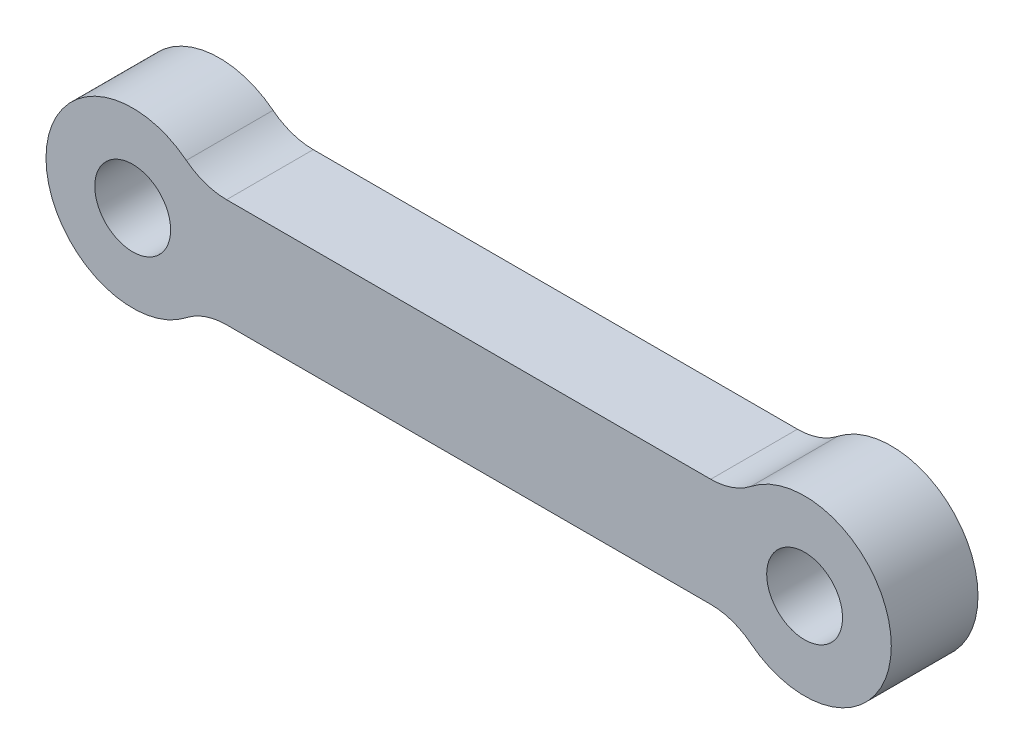
from build123d import *

# Parameters (mm, degrees)
SKETCH1_R           = 1.750000249
BOSS_EXTRUDE1_DEPTH = 4
FILLET1_R           = 3


with BuildPart() as part:
    # Sketch1 → Boss-Extrude1 (new body)
    with BuildSketch(Plane.XY):
        with BuildLine():
            Line((3.122495264, 2.500004665), (27.877504736, 2.500004665))
            ThreePointArc((27.877504736, 2.500004665), (35, 0), (27.877504736, -2.500004665))
            Line((27.877504736, -2.500004665), (3.122495264, -2.500004665))
            ThreePointArc((3.122495264, -2.500004665), (-4, 0), (3.122495264, 2.500004665))
        make_face()
        Circle(SKETCH1_R, mode=Mode.SUBTRACT)
        with Locations(Location((31, 0, 0), (0, 0, 180))):
            Circle(SKETCH1_R, mode=Mode.SUBTRACT)
    extrude(amount=BOSS_EXTRUDE1_DEPTH)

    # Fillet1
    fillet1_edges = [part.edges().sort_by_distance(p)[0] for p in [
        (27.877504736, -2.500004665, 2),
        (3.122495264, -2.500004665, 2),
        (3.122495264, 2.500004665, 2),
        (27.877504736, 2.500004665, 2),
    ]]
    fillet(fillet1_edges, radius=FILLET1_R)


solid = part.part
